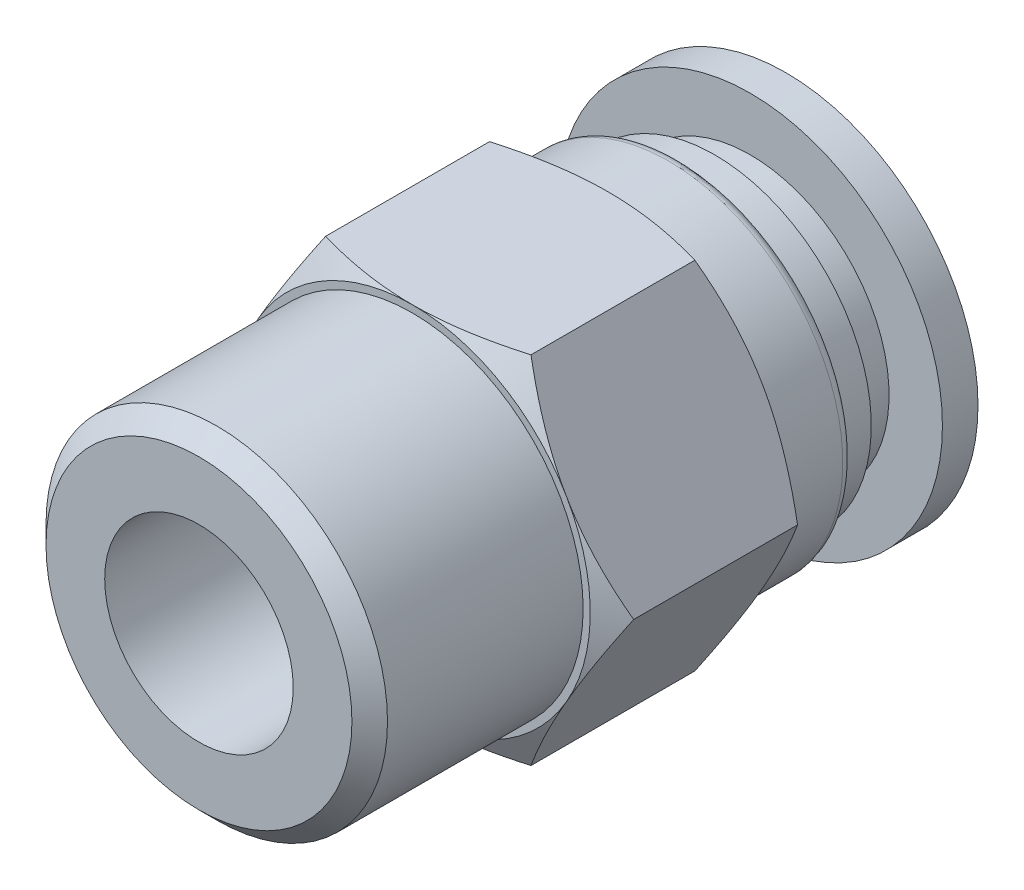
from build123d import *

# Parameters (mm, degrees)
SALIENTE_EXTRUIR1_DEPTH                              = 5.5
REFRENTADO_PARA_PERNO_CON_CABEZA_HEXAGON_D           = 5.3
REFRENTADO_PARA_PERNO_CON_CABEZA_HEXAGON_CBORE_D     = 6.8
REFRENTADO_PARA_PERNO_CON_CABEZA_HEXAGON_CBORE_DEPTH = 6


with BuildPart() as part:
    # Croquis1 → Saliente-Extruir1 (new body)
    with BuildSketch(Plane(origin=(0, 0, 0), x_dir=(-1, 0, 0), z_dir=(0, 0, -1))):
        Polygon((5.773502692, 0), (2.886751346, 5), (-2.886751346, 5), (-5.773502692, 0), (-2.886751346, -5), (2.886751346, -5), align=None)
    extrude(amount=-SALIENTE_EXTRUIR1_DEPTH)

    # Croquis2 → Revolución1 (revolve)
    with BuildSketch(Plane.XZ, mode=Mode.PRIVATE) as revoluci_n1_sk:
        Polygon((4.3, 11.5), (0, 11.5), (0, 5.5), (4.8, 5.5), (4.8, 11), align=None)
    revolve(revoluci_n1_sk.sketch.rotate(Axis((0, 0, 11.5), (0, 0, -1)), 180), axis=Axis((0, 0, 11.5), (0, 0, -1)))

    # Croquis3 → Revolución2 (revolve)
    with BuildSketch(Plane.XZ, mode=Mode.PRIVATE) as revoluci_n2_sk:
        with BuildLine():
            Line((4.9, 0), (0, 0))
            Line((0, 0), (0, -5))
            Line((0, -5), (5.4, -5))
            Line((5.4, -5), (5.4, -4))
            Line((5.4, -4), (3.9, -4))
            Line((3.9, -4), (3.9, -3))
            Line((3.9, -3), (4.4, -3))
            Line((4.4, -3), (4.4, -2))
            Line((4.4, -2), (4.6, -2))
            ThreePointArc((4.6, -2), (4.812132034, -1.912132034), (4.9, -1.7))
            Line((4.9, -1.7), (4.9, 0))
        make_face()
    revolve(revoluci_n2_sk.sketch.rotate(Axis((0, 0, 0), (0, 0, -1)), 180), axis=Axis((0, 0, 0), (0, 0, -1)))

    # Refrentado para perno con cabeza hexagonal de M51 (through all)
    with Locations(Plane(origin=(0, 0, -5), x_dir=(-1, 0, 0), z_dir=(0, 0, -1))):
        with Locations((0, 0)):
            CounterBoreHole(REFRENTADO_PARA_PERNO_CON_CABEZA_HEXAGON_D / 2, REFRENTADO_PARA_PERNO_CON_CABEZA_HEXAGON_CBORE_D / 2, REFRENTADO_PARA_PERNO_CON_CABEZA_HEXAGON_CBORE_DEPTH)

    # Croquis9 → Cortar-Revolución1 (revolve, cut)
    with BuildSketch(Plane(origin=(0, 0, 0), x_dir=(0, 0, -1), z_dir=(1, 0, 0)), mode=Mode.PRIVATE) as cortar_revoluci_n1_sk:
        Polygon((-5.5, 5), (-5.5, 6.59303143), (-4.580262875, 6.59303143), align=None)
        Polygon((-0.919737125, 6.59303143), (0, 5), (0, 6.59303143), align=None)
    revolve(cortar_revoluci_n1_sk.sketch.rotate(Axis((0, 0, 0), (0, 0, 1)), 90), axis=Axis((0, 0, 0), (0, 0, 1)), mode=Mode.SUBTRACT)


solid = part.part
